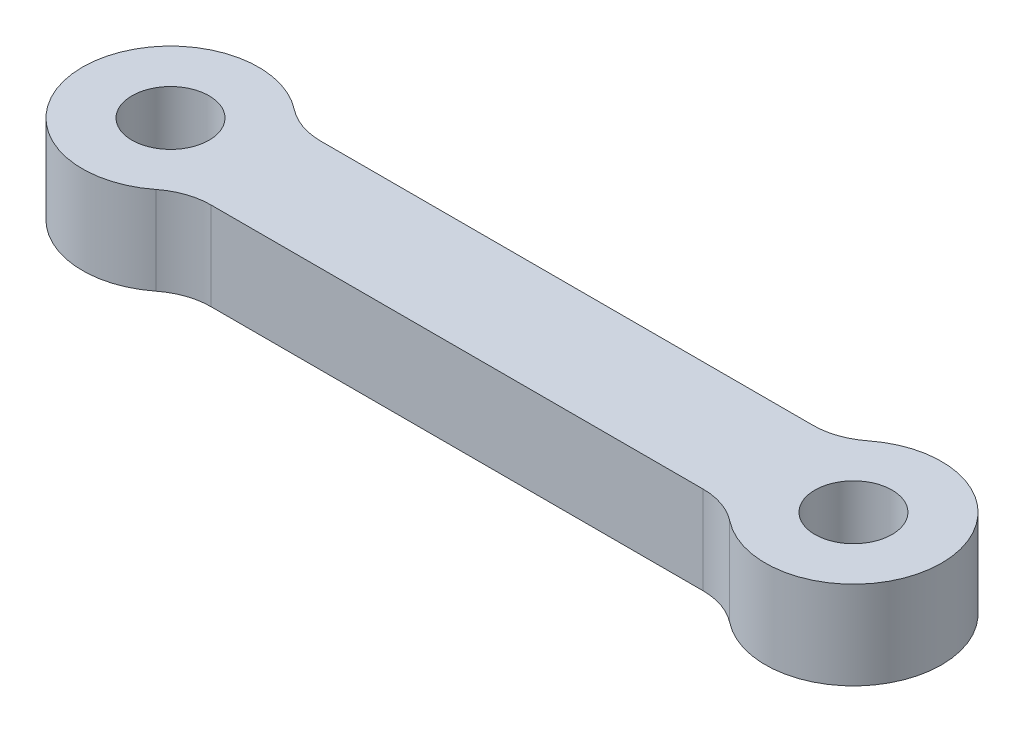
from build123d import *

# Parameters (mm, degrees)
SKETCH1_R           = 4
SKETCH1_R_2         = 1.75
BOSS_EXTRUDE1_DEPTH = 4
FILLET1_R           = 3


with BuildPart() as part:
    # Sketch1 → Boss-Extrude1 (new body)
    # profile 1 of 3: a face of its own
    with BuildSketch(Plane(origin=(0, 0, 0), x_dir=(1, 0, 0), z_dir=(0, 1, 0))):
        Circle(SKETCH1_R)
        with Locations(Location((0, 0, 0), (0, 0, 270))):
            Circle(SKETCH1_R_2, mode=Mode.SUBTRACT)
    # profile 2 of 3: a face of its own
    with BuildSketch(Plane(origin=(0, 0, 0), x_dir=(1, 0, 0), z_dir=(0, 1, 0))):
        with Locations((31, 0)):
            Circle(SKETCH1_R)
        with Locations(Location((31, 0, 0), (0, 0, 270))):
            Circle(SKETCH1_R_2, mode=Mode.SUBTRACT)
    # profile 3 of 3: a face of its own
    with BuildSketch(Plane(origin=(0, 0, 0), x_dir=(1, 0, 0), z_dir=(0, 1, 0))):
        with BuildLine():
            Line((3.122498999, -2.5), (27.877501001, -2.5))
            ThreePointArc((27.877501001, -2.5), (27, 0), (27.877501001, 2.5))
            Line((27.877501001, 2.5), (3.122498999, 2.5))
            ThreePointArc((3.122498999, 2.5), (4, 0), (3.122498999, -2.5))
        make_face()
    extrude(amount=BOSS_EXTRUDE1_DEPTH)

    # Fillet1
    fillet1_edges = [part.edges().sort_by_distance(p)[0] for p in [
        (3.122498999, 2, 2.5),
        (3.122498999, 2, -2.5),
        (27.877501001, 2, -2.5),
        (27.877501001, 2, 2.5),
    ]]
    fillet(fillet1_edges, radius=FILLET1_R)


solid = part.part
